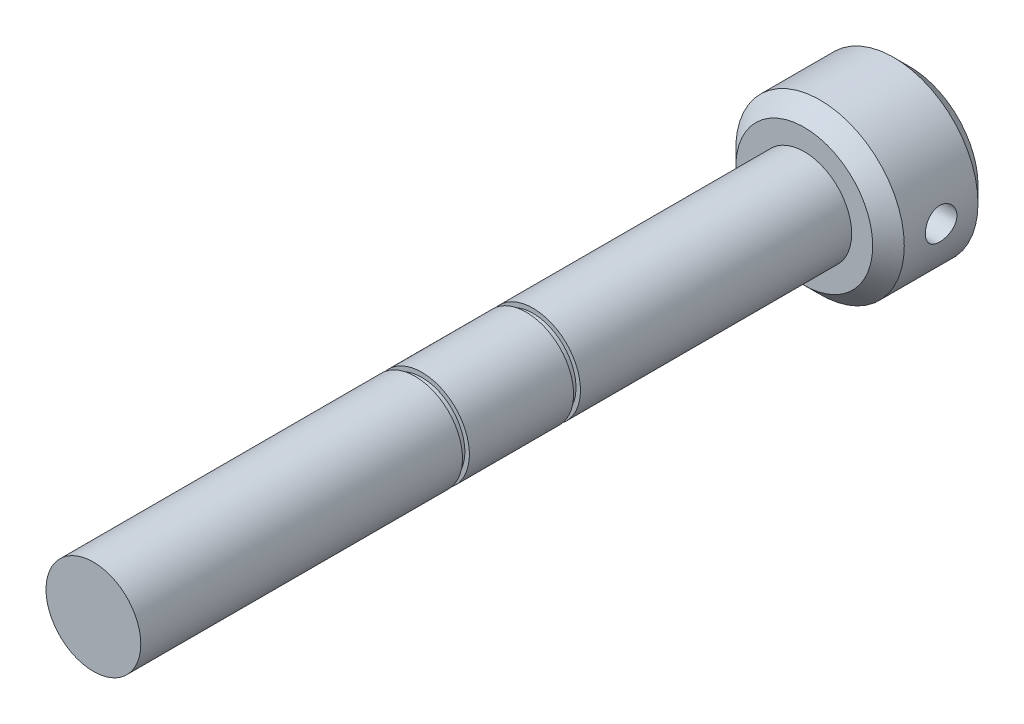
from build123d import *

# Parameters (mm, degrees)
SKETCH1_R               = 16
BOSS_EXTRUDE1_DEPTH     = 20
SKETCH2_R               = 9
BOSS_EXTRUDE2_DEPTH     = 135
SKETCH3_W               = 1.3
SKETCH3_H               = 0.85
CUT_EXTRUDE1_DEPTH      = 157.642906
CUT_EXTRUDE1_DEPTH_BACK = 157.642906
CHAMFER1_SIZE           = 3


with BuildPart() as part:
    # Sketch1 → Boss-Extrude1 (new body)
    with BuildSketch(Plane.XY):
        Circle(SKETCH1_R)
    extrude(amount=BOSS_EXTRUDE1_DEPTH)

    # Sketch2 → Boss-Extrude2 (add)
    with BuildSketch(Plane.XY.offset(20)):
        Circle(SKETCH2_R)
    extrude(amount=BOSS_EXTRUDE2_DEPTH)

    # Sketch3 → Cut-Revolve1 (revolve, cut)
    with BuildSketch(Plane(origin=(0, 0, 0), x_dir=(0, 0, -1), z_dir=(1, 0, 0)), mode=Mode.PRIVATE) as cut_revolve1_sk:
        with Locations((-72.15, 8.575)):
            Rectangle(SKETCH3_W, SKETCH3_H)
        with Locations((-93.25, 8.575)):
            Rectangle(SKETCH3_W, SKETCH3_H)
    revolve(cut_revolve1_sk.sketch.rotate(Axis((0, 0, 0), (0, 0, 1)), 90), axis=Axis((0, 0, 0), (0, 0, 1)), mode=Mode.SUBTRACT)

    # Sketch4 → Cut-Extrude1 (cut, two sides: drawn at the far end of the back side and taken through both)
    with BuildSketch(Plane(origin=(0, 0, 0), x_dir=(0, 0, -1), z_dir=(1, 0, 0)).offset(-CUT_EXTRUDE1_DEPTH_BACK)):
        with BuildLine():
            ThreePointArc((-8.41000318, 2.543994912), (-10, 3), (-11.58999682, 2.543994912))
            Line((-11.58999682, 2.543994912), (-10, 0))
            Line((-10, 0), (-8.41000318, 2.543994912))
        make_face()
        with BuildLine():
            Line((-10, 0), (-11.58999682, 2.543994912))
            ThreePointArc((-11.58999682, 2.543994912), (-13, 0), (-11.58999682, -2.543994912))
            Line((-11.58999682, -2.543994912), (-10, 0))
        make_face()
        with BuildLine():
            Line((-10, 0), (-11.58999682, -2.543994912))
            ThreePointArc((-11.58999682, -2.543994912), (-10, -3), (-8.41000318, -2.543994912))
            Line((-8.41000318, -2.543994912), (-10, 0))
        make_face()
        with BuildLine():
            ThreePointArc((-7, 0), (-7.376072556, 1.454305597), (-8.41000318, 2.543994912))
            Line((-8.41000318, 2.543994912), (-10, 0))
            Line((-10, 0), (-8.41000318, -2.543994912))
            ThreePointArc((-8.41000318, -2.543994912), (-7.376072556, -1.454305597), (-7, 0))
        make_face()
    extrude(amount=CUT_EXTRUDE1_DEPTH + CUT_EXTRUDE1_DEPTH_BACK, mode=Mode.SUBTRACT)

    # Chamfer1
    chamfer1_edges = [part.edges().sort_by_distance(p)[0] for p in [
        (-16, 0, 0),
        (-16, 0, 20),
    ]]
    chamfer(chamfer1_edges, length=CHAMFER1_SIZE)


solid = part.part
